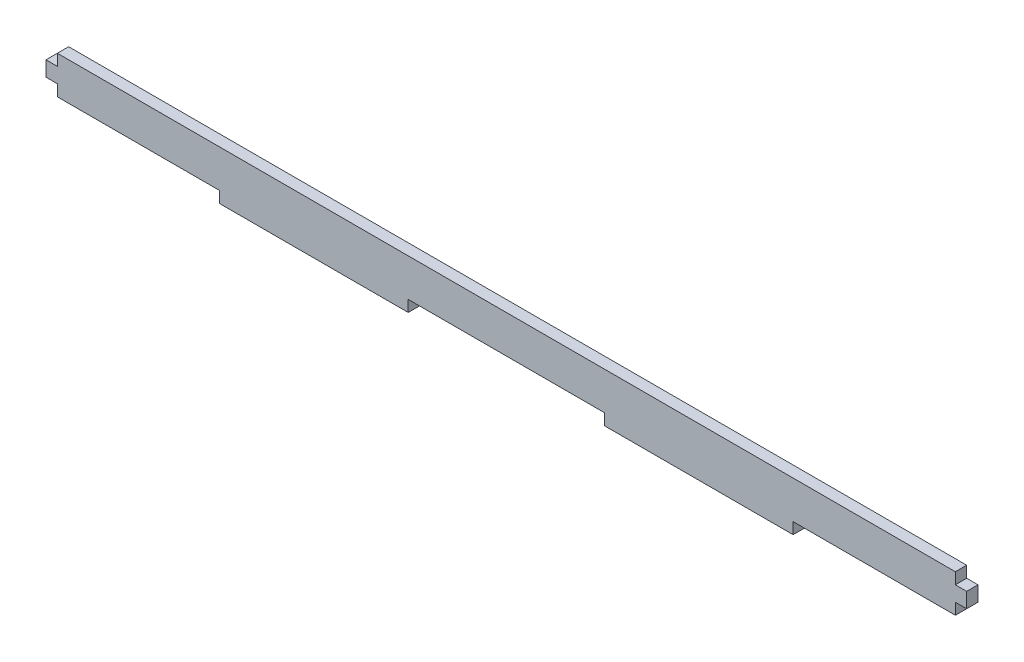
from build123d import *

# Parameters (mm, degrees)
BOSS_EXTRUDE1_DEPTH = 3


with BuildPart() as part:
    # Sketch1 → Boss-Extrude1 (new body)
    with BuildSketch(Plane.XY):
        Polygon((93, 0), (145, 0), (145, -3), (195, -3), (195, 0), (238, 0), (238, 3), (241, 3), (241, 7), (238, 7), (238, 10), (0, 10), (0, 7), (-3, 7), (-3, 3), (0, 3), (0, 0), (43, 0), (43, -3), (93, -3), align=None)
    extrude(amount=BOSS_EXTRUDE1_DEPTH)


solid = part.part
